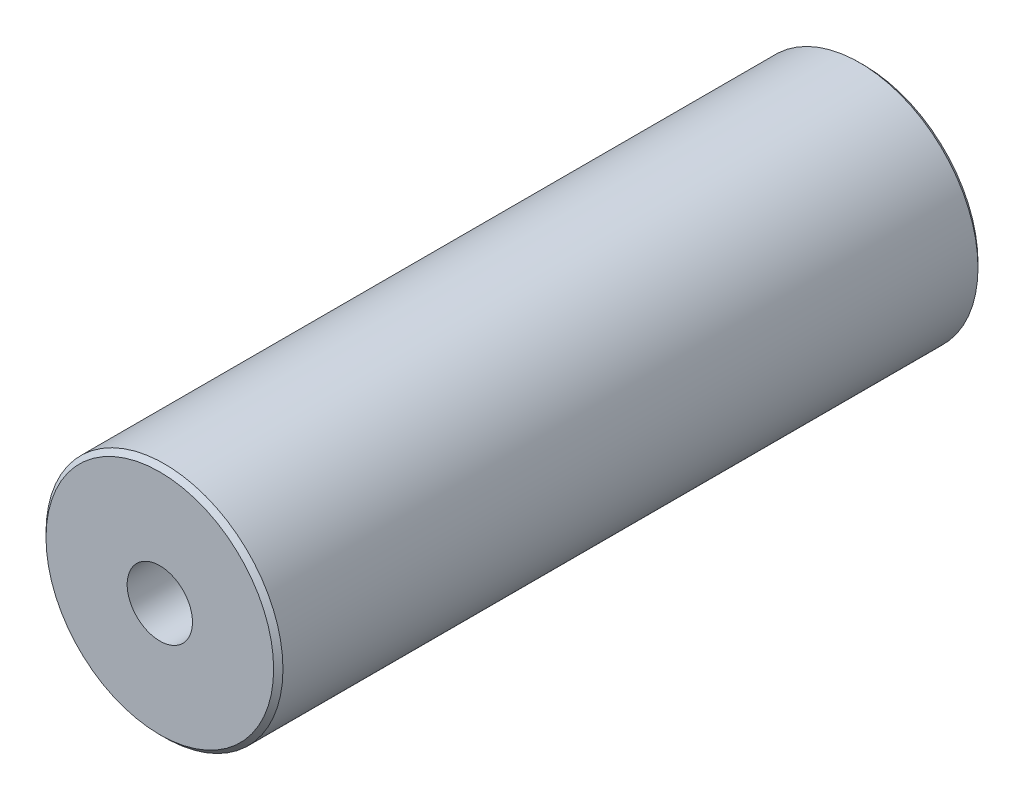
from build123d import *

# Parameters (mm, degrees)
SKETCH1_R           = 12.7
BOSS_EXTRUDE1_DEPTH = 37.75
CHAMFER1_SIZE       = 0.5


with BuildPart() as part:
    # Sketch1 → Boss-Extrude1 (new, symmetric)
    with BuildSketch(Plane.XY):
        Circle(SKETCH1_R)
    extrude(amount=BOSS_EXTRUDE1_DEPTH, both=True)

    # Sketch2 → M8x1.0 Tapped Hole1 (revolve, cut)
    with BuildSketch(Plane(origin=(0, 0, 37.75), x_dir=(0, -1, 0), z_dir=(1, 0, 0))):
        Polygon((0, 0), (0, 14.103012167), (3.5, 12), (3.5, 0), align=None)
    m8x1_0_tapped_hole1 = revolve(axis=Axis((0, 0, 44.1), (0, 0, -1)), mode=Mode.SUBTRACT)

    # Mirror1: M8x1.0 Tapped Hole1 across plane
    add(m8x1_0_tapped_hole1.mirror(Plane.XY), mode=Mode.SUBTRACT)

    # Chamfer1
    chamfer1_edges = [part.edges().sort_by_distance(p)[0] for p in [
        (-12.7, 0, -37.75),
        (-12.7, 0, 37.75),
    ]]
    chamfer(chamfer1_edges, length=CHAMFER1_SIZE)


solid = part.part
